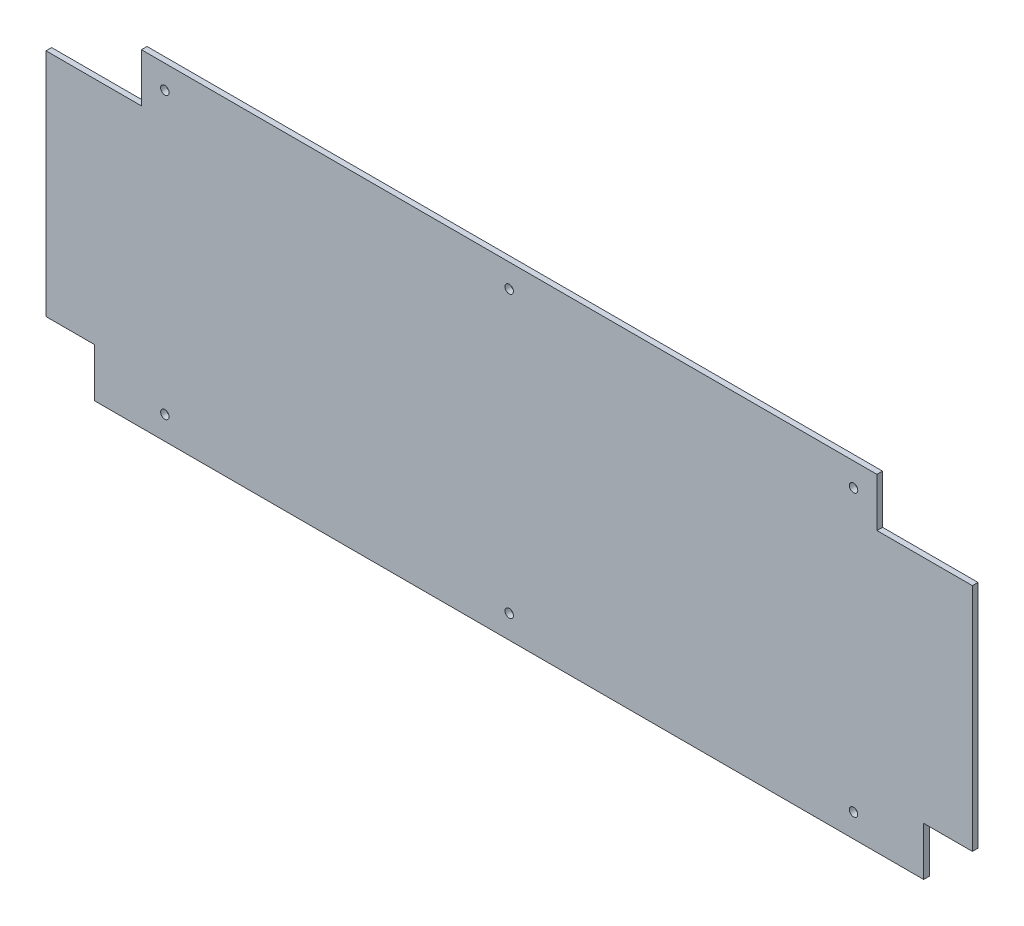
from build123d import *

# Parameters (mm, degrees)
BOSS_EXTRUDE1_DEPTH  = 3
M4_CLEARANCE_HOLE1_D = 4.5


with BuildPart() as part:
    # Sketch1 → Boss-Extrude1 (new body)
    with BuildSketch(Plane.XY):
        Polygon((31.645266951, 0), (474.645266951, 0), (474.645266951, 26), (500.645266951, 26), (500.645266951, 149), (449.645266951, 149), (449.645266951, 175), (56.645266951, 175), (56.645266951, 149), (5.645266951, 149), (5.645266951, 26), (31.645266951, 26), align=None)
    extrude(amount=BOSS_EXTRUDE1_DEPTH)

    # M4 Clearance Hole1 (through all)
    with Locations(Plane.XY.offset(3)):
        with Locations((253.145266951, 12.5), (253.145266951, 162.5), (437.145266951, 12.5), (437.145266951, 162.5), (69.145266951, 162.5), (69.145266951, 12.5)):
            Hole(M4_CLEARANCE_HOLE1_D / 2)


solid = part.part
